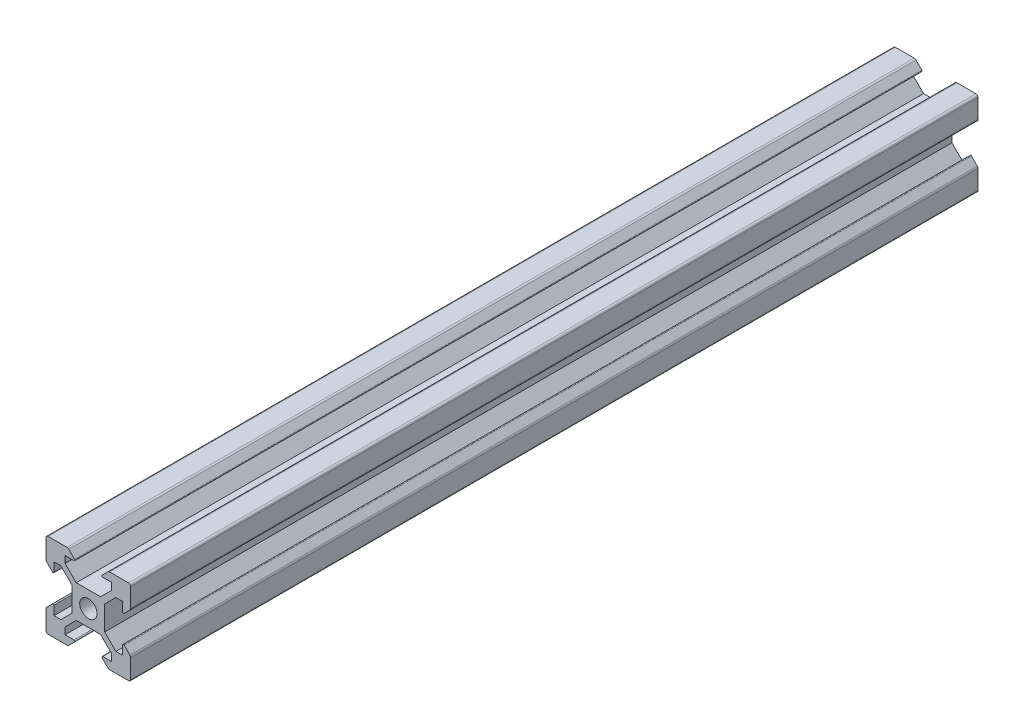
from build123d import *

# Parameters (mm, degrees)
SKETCH1_R           = 2.05
BOSS_EXTRUDE1_DEPTH = 200


with BuildPart() as part:
    # Sketch1 → Boss-Extrude1 (new body)
    with BuildSketch(Plane(origin=(0, 0, 0), x_dir=(0, 1, 0), z_dir=(0, 0, 1))):
        with BuildLine():
            Line((-2.860050506, -3.85), (2.860050506, -3.85))
            Line((2.860050506, -3.85), (5.5, -6.489949494))
            Line((5.5, -6.489949494), (5.5, -8.1))
            Line((5.5, -8.1), (3.382842712, -8.1))
            ThreePointArc((3.382842712, -8.1), (3.198066806, -8.223463314), (3.241421356, -8.441421356))
            Line((3.241421356, -8.441421356), (4.624264069, -9.824264069))
            ThreePointArc((4.624264069, -9.824264069), (4.818918078, -9.95432772), (5.048528137, -10))
            Line((5.048528137, -10), (9.5, -10))
            ThreePointArc((9.5, -10), (9.853553391, -9.853553391), (10, -9.5))
            Line((10, -9.5), (10, -5.048528137))
            ThreePointArc((10, -5.048528137), (9.95432772, -4.818918078), (9.824264069, -4.624264069))
            Line((9.824264069, -4.624264069), (8.441421356, -3.241421356))
            ThreePointArc((8.441421356, -3.241421356), (8.223463314, -3.198066806), (8.1, -3.382842712))
            Line((8.1, -3.382842712), (8.1, -5.5))
            Line((8.1, -5.5), (6.489949494, -5.5))
            Line((6.489949494, -5.5), (3.85, -2.860050506))
            Line((3.85, -2.860050506), (3.85, 2.860050506))
            Line((3.85, 2.860050506), (6.489949494, 5.5))
            Line((6.489949494, 5.5), (8.1, 5.5))
            Line((8.1, 5.5), (8.1, 3.382842712))
            ThreePointArc((8.1, 3.382842712), (8.223463314, 3.198066806), (8.441421356, 3.241421356))
            Line((8.441421356, 3.241421356), (9.824264069, 4.624264069))
            ThreePointArc((9.824264069, 4.624264069), (9.95432772, 4.818918078), (10, 5.048528137))
            Line((10, 5.048528137), (10, 9.5))
            ThreePointArc((10, 9.5), (9.853553391, 9.853553391), (9.5, 10))
            Line((9.5, 10), (5.048528137, 10))
            ThreePointArc((5.048528137, 10), (4.818918078, 9.95432772), (4.624264069, 9.824264069))
            Line((4.624264069, 9.824264069), (3.241421356, 8.441421356))
            ThreePointArc((3.241421356, 8.441421356), (3.198066806, 8.223463314), (3.382842712, 8.1))
            Line((3.382842712, 8.1), (5.5, 8.1))
            Line((5.5, 8.1), (5.5, 6.489949494))
            Line((5.5, 6.489949494), (2.860050506, 3.85))
            Line((2.860050506, 3.85), (-2.860050506, 3.85))
            Line((-2.860050506, 3.85), (-5.5, 6.489949494))
            Line((-5.5, 6.489949494), (-5.5, 8.1))
            Line((-5.5, 8.1), (-3.382842712, 8.1))
            ThreePointArc((-3.382842712, 8.1), (-3.198066806, 8.223463314), (-3.241421356, 8.441421356))
            Line((-3.241421356, 8.441421356), (-4.624264069, 9.824264069))
            ThreePointArc((-4.624264069, 9.824264069), (-4.818918078, 9.95432772), (-5.048528137, 10))
            Line((-5.048528137, 10), (-9.5, 10))
            ThreePointArc((-9.5, 10), (-9.853553391, 9.853553391), (-10, 9.5))
            Line((-10, 9.5), (-10, 5.048528137))
            ThreePointArc((-10, 5.048528137), (-9.95432772, 4.818918078), (-9.824264069, 4.624264069))
            Line((-9.824264069, 4.624264069), (-8.441421356, 3.241421356))
            ThreePointArc((-8.441421356, 3.241421356), (-8.223463314, 3.198066806), (-8.1, 3.382842712))
            Line((-8.1, 3.382842712), (-8.1, 5.5))
            Line((-8.1, 5.5), (-6.489949494, 5.5))
            Line((-6.489949494, 5.5), (-3.85, 2.860050506))
            Line((-3.85, 2.860050506), (-3.85, -2.860050506))
            Line((-3.85, -2.860050506), (-6.489949494, -5.5))
            Line((-6.489949494, -5.5), (-8.1, -5.5))
            Line((-8.1, -5.5), (-8.1, -3.382842712))
            ThreePointArc((-8.1, -3.382842712), (-8.223463314, -3.198066806), (-8.441421356, -3.241421356))
            Line((-8.441421356, -3.241421356), (-9.824264069, -4.624264069))
            ThreePointArc((-9.824264069, -4.624264069), (-9.95432772, -4.818918078), (-10, -5.048528137))
            Line((-10, -5.048528137), (-10, -9.5))
            ThreePointArc((-10, -9.5), (-9.853553391, -9.853553391), (-9.5, -10))
            Line((-9.5, -10), (-5.048528137, -10))
            ThreePointArc((-5.048528137, -10), (-4.818918078, -9.95432772), (-4.624264069, -9.824264069))
            Line((-4.624264069, -9.824264069), (-3.241421356, -8.441421356))
            ThreePointArc((-3.241421356, -8.441421356), (-3.198066806, -8.223463314), (-3.382842712, -8.1))
            Line((-3.382842712, -8.1), (-5.5, -8.1))
            Line((-5.5, -8.1), (-5.5, -6.489949494))
            Line((-5.5, -6.489949494), (-2.860050506, -3.85))
        make_face()
        with Locations(Location((0, 0, 0), (0, 0, 270))):
            Circle(SKETCH1_R, mode=Mode.SUBTRACT)
    extrude(amount=BOSS_EXTRUDE1_DEPTH)


solid = part.part
